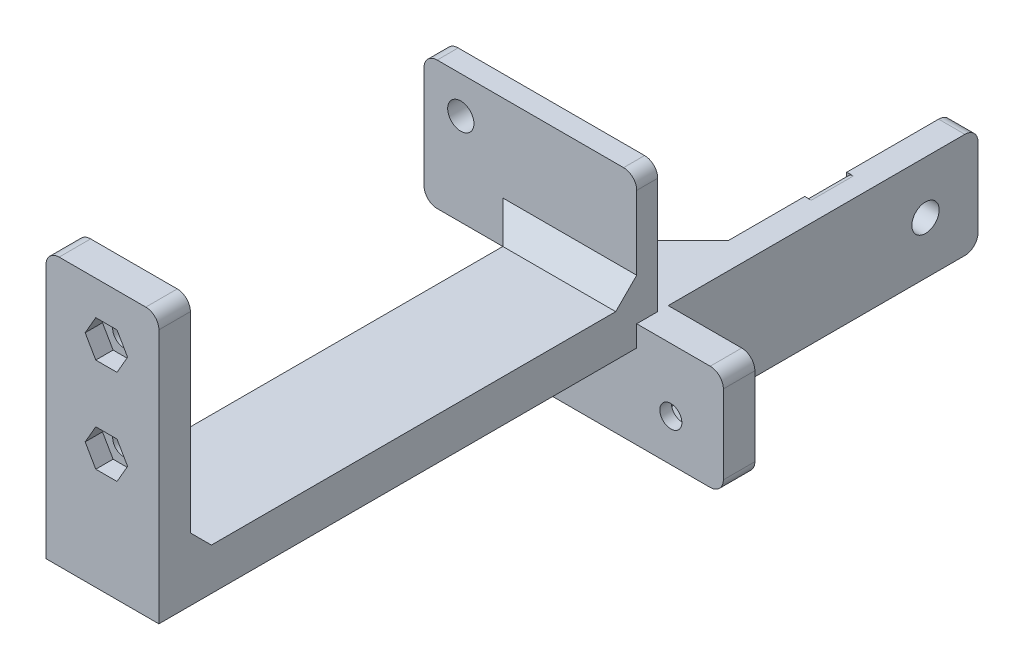
from build123d import *

# Parameters (mm, degrees)
SKETCH_3_W          = 38
SKETCH_3_H          = 20
EXTRUDE_1_DEPTH     = 6
SKETCH_4_W          = 5
SKETCH_4_H          = 20
EXTRUDE_2_DEPTH     = 59
SKETCH_9_W          = 40.5
SKETCH_9_H          = 24.5
EXTRUDE_4_DEPTH     = 4
SKETCH_12_W         = 21.5
SKETCH_12_H         = 85
EXTRUDE_5_DEPTH     = 4
SKETCH_13_W         = 21.5
SKETCH_13_H         = 51
EXTRUDE_6_DEPTH     = 6
EXTRUDE_8_DEPTH     = 4
CUT_EXTRUDE_START   = -20
CUT_EXTRUDE_7_DEPTH = 8
SKETCH_5_R          = 2.1
CUT_EXTRUDE_1_DEPTH = 114.903467902
CUT_EXTRUDE_2_DEPTH = 3.8
SKETCH_7_R          = 2.6
CUT_EXTRUDE_3_DEPTH = 120.57529009
SKETCH_17_R         = 2.1
CUT_EXTRUDE_4_DEPTH = 165.903001792
CUT_EXTRUDE_5_DEPTH = 3.3
SKETCH_19_R         = 2.5
CUT_EXTRUDE_6_DEPTH = 118.123866056
FILLET_2_R          = 2.5
CHAMFER_2_SIZE      = 4


with BuildPart() as part:
    # Эскиз3 → Бобышка-Вытянуть1 (new body)
    with BuildSketch(Plane.XY):
        Rectangle(SKETCH_3_W, SKETCH_3_H)
    extrude(amount=EXTRUDE_1_DEPTH)

    # Эскиз4 → Бобышка-Вытянуть2 (add)
    with BuildSketch(Plane(origin=(-10.8, 0, 0), x_dir=(1, 0, 0), z_dir=(0, 0, 1))):
        with Locations((10.8, 0)):
            Rectangle(SKETCH_4_W, SKETCH_4_H)
    extrude(amount=-EXTRUDE_2_DEPTH)

    # Эскиз9 → Бобышка-Вытянуть4 (add)
    with BuildSketch(Plane.XY.offset(6)):
        with Locations((-17.75, 22.25)):
            Rectangle(SKETCH_9_W, SKETCH_9_H)
    extrude(amount=-EXTRUDE_4_DEPTH)

    # Эскиз12 → Бобышка-Вытянуть5 (add, symmetric)
    with BuildSketch(Plane(origin=(0, 10, 0), x_dir=(-1, 0, 0), z_dir=(0, 1, 0))):
        with Locations((8.25, 48.5)):
            Rectangle(SKETCH_12_W, SKETCH_12_H)
    extrude(amount=EXTRUDE_5_DEPTH, both=True)

    # Эскиз13 → Бобышка-Вытянуть6 (add)
    with BuildSketch(Plane.XY.offset(91)):
        with Locations((-8.25, 31.5)):
            Rectangle(SKETCH_13_W, SKETCH_13_H)
    extrude(amount=EXTRUDE_6_DEPTH)

    # Эскиз23 → Бобышка-Вытянуть8 (add)
    with BuildSketch(Plane(origin=(0, 10, 0), x_dir=(1, 0, 0), z_dir=(0, 1, 0))):
        Polygon((-2.5, 16.5), (-19, 0), (-2.5, 0), align=None)
    extrude(amount=-EXTRUDE_8_DEPTH)

    # Эскиз21 → Вырез-Вытянуть7 (cut)
    with BuildSketch(Plane(origin=(0, 0, -59), x_dir=(-1, 0, 0), z_dir=(0, 0, -1)).offset(CUT_EXTRUDE_START)):
        with BuildLine():
            Line((1.25, 10), (2.5, 10))
            Line((2.5, 10), (2.5, 8.75))
            ThreePointArc((2.5, 8.75), (2.133883476, 9.633883476), (1.25, 10))
        make_face()
    extrude(amount=-CUT_EXTRUDE_7_DEPTH, mode=Mode.SUBTRACT)

    # Эскиз5 → Вырез-Вытянуть1 (cut, through all)
    with BuildSketch(Plane.XY.offset(6)):
        with Locations((-9, -2)):
            Circle(SKETCH_5_R)
        with Locations((9, -2)):
            Circle(SKETCH_5_R)
    extrude(amount=-CUT_EXTRUDE_1_DEPTH, mode=Mode.SUBTRACT)

    # Эскиз6 → Вырез-Вытянуть2 (cut)
    with BuildSketch(Plane(origin=(0, 0, 0), x_dir=(-1, 0, 0), z_dir=(0, 0, -1))):
        Polygon((-9, 2.156921938), (-12.6, 0.078460969), (-12.6, -4.078460969), (-9, -6.156921938), (-5.4, -4.078460969), (-5.4, 0.078460969), align=None)
        Polygon((9, 2.156921938), (5.4, 0.078460969), (5.4, -4.078460969), (9, -6.156921938), (12.6, -4.078460969), (12.6, 0.078460969), align=None)
    extrude(amount=-CUT_EXTRUDE_2_DEPTH, mode=Mode.SUBTRACT)

    # Эскиз7 → Вырез-Вытянуть3 (cut, through all)
    with BuildSketch(Plane(origin=(2.5, 0, 0), x_dir=(0, 0, -1), z_dir=(1, 0, 0))):
        with Locations(Location((49, 0, 0), (0, 0, 90))):
            Circle(SKETCH_7_R)
    extrude(amount=-CUT_EXTRUDE_3_DEPTH, mode=Mode.SUBTRACT)

    # Эскиз17 → Вырез-Вытянуть4 (cut, through all)
    with BuildSketch(Plane(origin=(0, 0, 91), x_dir=(-1, 0, 0), z_dir=(0, 0, -1))):
        with Locations((7.5, 29)):
            Circle(SKETCH_17_R)
        with Locations((7.5, 47)):
            Circle(SKETCH_17_R)
    extrude(amount=-CUT_EXTRUDE_4_DEPTH, mode=Mode.SUBTRACT)

    # Эскиз18 → Вырез-Вытянуть5 (cut)
    with BuildSketch(Plane.XY.offset(97)):
        Polygon((-3.458548116, 29), (-5.479274058, 32.5), (-9.520725942, 32.5), (-11.541451884, 29), (-9.520725942, 25.5), (-5.479274058, 25.5), align=None)
        Polygon((-3.458548116, 47), (-5.479274058, 50.5), (-9.520725942, 50.5), (-11.541451884, 47), (-9.520725942, 43.5), (-5.479274058, 43.5), align=None)
    extrude(amount=-CUT_EXTRUDE_5_DEPTH, mode=Mode.SUBTRACT)

    # Эскиз19 → Вырез-Вытянуть6 (cut, through all)
    with BuildSketch(Plane(origin=(0, 0, 2), x_dir=(-1, 0, 0), z_dir=(0, 0, -1))):
        with Locations((30.999999999, 27.499999999)):
            Circle(SKETCH_19_R)
    extrude(amount=-CUT_EXTRUDE_6_DEPTH, mode=Mode.SUBTRACT)

    # Скругление2
    fillet_2_edges = [part.edges().sort_by_distance(p)[0] for p in [
        (0, 10, -59),
        (0, -10, -59),
        (2.5, 34.5, 4),
        (-38, 10, 4),
        (-38, 34.5, 4),
        (2.5, 57, 94),
        (-19, 57, 94),
        (19, 10, 3),
        (19, -10, 3),
        (-19, -10, 3),
    ]]
    fillet(fillet_2_edges, radius=FILLET_2_R)

    # Фаска2
    chamfer_2_edges = [part.edges().sort_by_distance(p)[0] for p in [
        (-19, 12, 6),
        (-8.25, 14, 91),
        (-8.25, 14, 6),
    ]]
    chamfer(chamfer_2_edges, length=CHAMFER_2_SIZE)


solid = part.part
